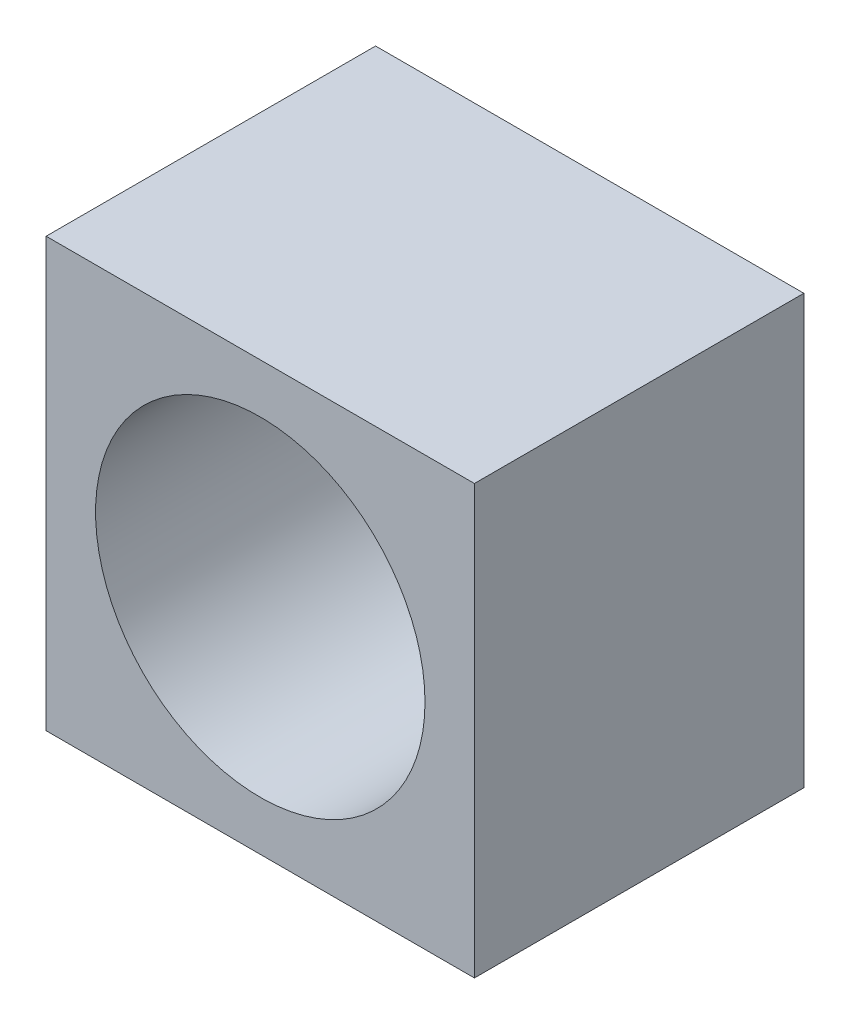
from build123d import *

# Parameters (mm, degrees)
SCHIZZO13_W                  = 13
SCHIZZO13_H                  = 13
SCHIZZO13_R                  = 5
ESTRUSIONE_ESTRUSIONE1_DEPTH = 10


with BuildPart() as part:
    # Schizzo13 → Estrusione-Estrusione1 (new body)
    with BuildSketch(Plane.XY):
        Rectangle(SCHIZZO13_W, SCHIZZO13_H)
        Circle(SCHIZZO13_R, mode=Mode.SUBTRACT)
    extrude(amount=ESTRUSIONE_ESTRUSIONE1_DEPTH)


solid = part.part
